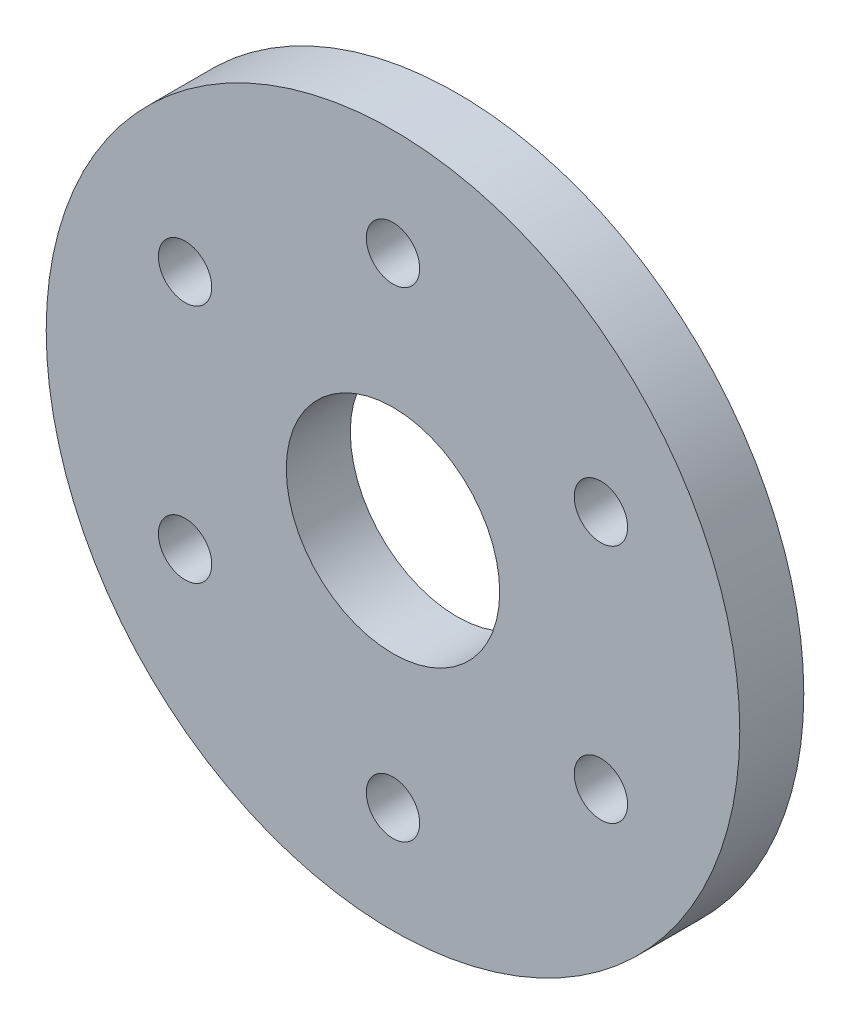
from build123d import *

# Parameters (mm, degrees)
SKETCH_1_R          = 32.5
SKETCH_1_R_2        = 10
EXTRUDE_1_DEPTH     = 6
SKETCH_2_R          = 2.5
CUT_EXTRUDE_1_DEPTH = 6


with BuildPart() as part:
    # 草图1 → 凸台-拉伸1 (new body)
    with BuildSketch(Plane.XY):
        Circle(SKETCH_1_R)
        Circle(SKETCH_1_R_2, mode=Mode.SUBTRACT)
    extrude(amount=EXTRUDE_1_DEPTH)

    # 草图2 → 切除-拉伸1 (cut)
    with BuildSketch(Plane.XY.offset(6)):
        with Locations((0, 22.5)):
            Circle(SKETCH_2_R)
        with Locations((19.485571585, 11.25)):
            Circle(SKETCH_2_R)
        with Locations((19.485571585, -11.25)):
            Circle(SKETCH_2_R)
        with Locations((0, -22.5)):
            Circle(SKETCH_2_R)
        with Locations((-19.485571585, -11.25)):
            Circle(SKETCH_2_R)
        with Locations((-19.485571585, 11.25)):
            Circle(SKETCH_2_R)
    extrude(amount=-CUT_EXTRUDE_1_DEPTH, mode=Mode.SUBTRACT)


solid = part.part
